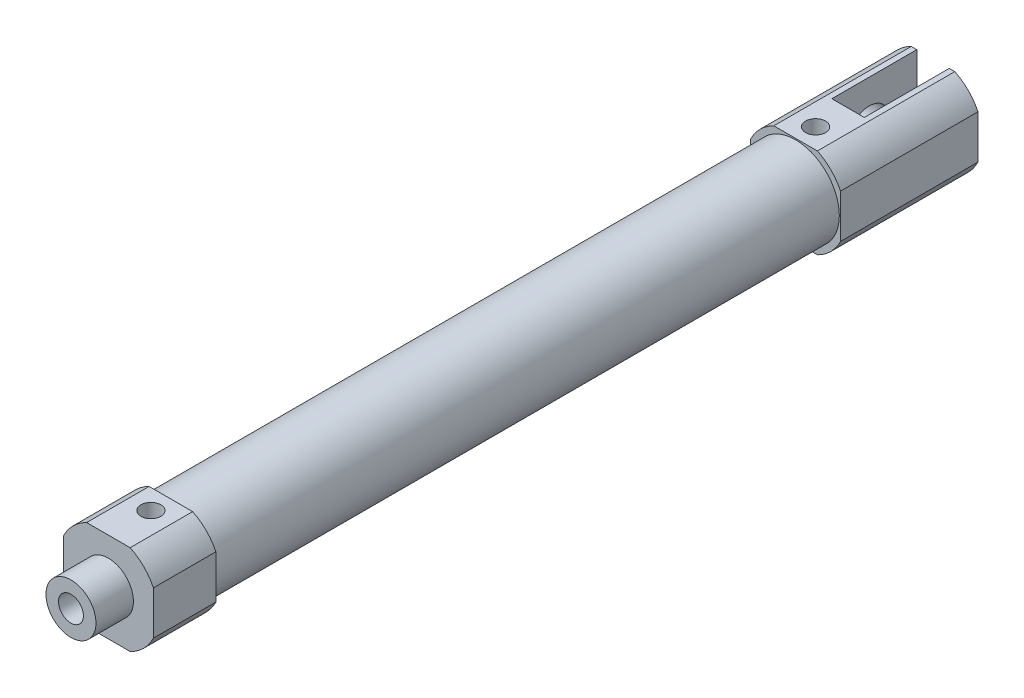
from build123d import *

# Parameters (mm, degrees)
BOSS_EXTRUDE1_DEPTH = 12.5
SKETCH2_R           = 5
BOSS_EXTRUDE2_DEPTH = 7.5
SKETCH3_R           = 8.75
BOSS_EXTRUDE3_DEPTH = 125
BOSS_EXTRUDE4_START = 27.5
BOSS_EXTRUDE4_DEPTH = 27.5
SKETCH7_W           = 6.5
SKETCH7_H           = 18
CUT_EXTRUDE1_DEPTH  = 17
SKETCH8_R           = 4
CUT_EXTRUDE2_DEPTH  = 17
SKETCH9_R           = 2
CUT_EXTRUDE3_DEPTH  = 4
SKETCH10_R          = 2
CUT_EXTRUDE4_DEPTH  = 4
SKETCH11_R          = 2.5
CUT_EXTRUDE5_DEPTH  = 100


with BuildPart() as part:
    # Sketch1 → Boss-Extrude1 (new body)
    with BuildSketch(Plane.XY):
        with BuildLine():
            ThreePointArc((-9, -4.358898944), (-7.071067812, -7.071067812), (-4.358898944, -9))
            Line((-4.358898944, -9), (4.358898944, -9))
            ThreePointArc((4.358898944, -9), (7.071067812, -7.071067812), (9, -4.358898944))
            Line((9, -4.358898944), (9, 4.358898944))
            ThreePointArc((9, 4.358898944), (7.071067812, 7.071067812), (4.358898944, 9))
            Line((4.358898944, 9), (-4.358898944, 9))
            ThreePointArc((-4.358898944, 9), (-7.071067812, 7.071067812), (-9, 4.358898944))
            Line((-9, 4.358898944), (-9, -4.358898944))
        make_face()
    extrude(amount=BOSS_EXTRUDE1_DEPTH)

    # Sketch2 → Boss-Extrude2 (add)
    with BuildSketch(Plane.XY.offset(12.5)):
        Circle(SKETCH2_R)
    extrude(amount=BOSS_EXTRUDE2_DEPTH)

    # Sketch3 → Boss-Extrude3 (add)
    with BuildSketch(Plane(origin=(0, 0, 0), x_dir=(-1, 0, 0), z_dir=(0, 0, -1))):
        with Locations(Location((0, 0, 0), (0, 0, 180))):
            Circle(SKETCH3_R)
    extrude(amount=BOSS_EXTRUDE3_DEPTH)

    # Sketch6 → Boss-Extrude4 (add)
    with BuildSketch(Plane(origin=(0, 0, -125), x_dir=(-1, 0, 0), z_dir=(0, 0, -1)).offset(BOSS_EXTRUDE4_START)):
        with BuildLine():
            Line((-4.358898944, -9), (4.358898944, -9))
            ThreePointArc((4.358898944, -9), (7.071067812, -7.071067812), (9, -4.358898944))
            Line((9, -4.358898944), (9, 4.358898944))
            ThreePointArc((9, 4.358898944), (7.071067812, 7.071067812), (4.358898944, 9))
            Line((4.358898944, 9), (-4.358898944, 9))
            ThreePointArc((-4.358898944, 9), (-7.071067812, 7.071067812), (-9, 4.358898944))
            Line((-9, 4.358898944), (-9, -4.358898944))
            ThreePointArc((-9, -4.358898944), (-7.071067812, -7.071067812), (-4.358898944, -9))
        make_face()
    extrude(amount=-BOSS_EXTRUDE4_DEPTH)

    # Sketch7 → Cut-Extrude1 (cut)
    with BuildSketch(Plane(origin=(0, 0, -152.5), x_dir=(-1, 0, 0), z_dir=(0, 0, -1))):
        Rectangle(SKETCH7_W, SKETCH7_H)
    extrude(amount=-CUT_EXTRUDE1_DEPTH, mode=Mode.SUBTRACT)

    # Sketch8 → Cut-Extrude2 (cut)
    with BuildSketch(Plane.ZY.offset(9)):
        with Locations((-143, 0)):
            Circle(SKETCH8_R)
    extrude(amount=-CUT_EXTRUDE2_DEPTH, mode=Mode.SUBTRACT)

    # Sketch9 → Cut-Extrude3 (cut)
    with BuildSketch(Plane(origin=(0, 9, 0), x_dir=(1, 0, 0), z_dir=(0, 1, 0))):
        with Locations(Location((0, 129, 0), (0, 0, 270))):
            Circle(SKETCH9_R)
    extrude(amount=-CUT_EXTRUDE3_DEPTH, mode=Mode.SUBTRACT)

    # Sketch10 → Cut-Extrude4 (cut)
    with BuildSketch(Plane(origin=(0, 9, 0), x_dir=(1, 0, 0), z_dir=(0, 1, 0))):
        with Locations(Location((0, -4, 0), (0, 0, 180))):
            Circle(SKETCH10_R)
    extrude(amount=-CUT_EXTRUDE4_DEPTH, mode=Mode.SUBTRACT)

    # Sketch11 → Cut-Extrude5 (cut)
    with BuildSketch(Plane.XY.offset(20)):
        Circle(SKETCH11_R)
    extrude(amount=-CUT_EXTRUDE5_DEPTH, mode=Mode.SUBTRACT)


solid = part.part
